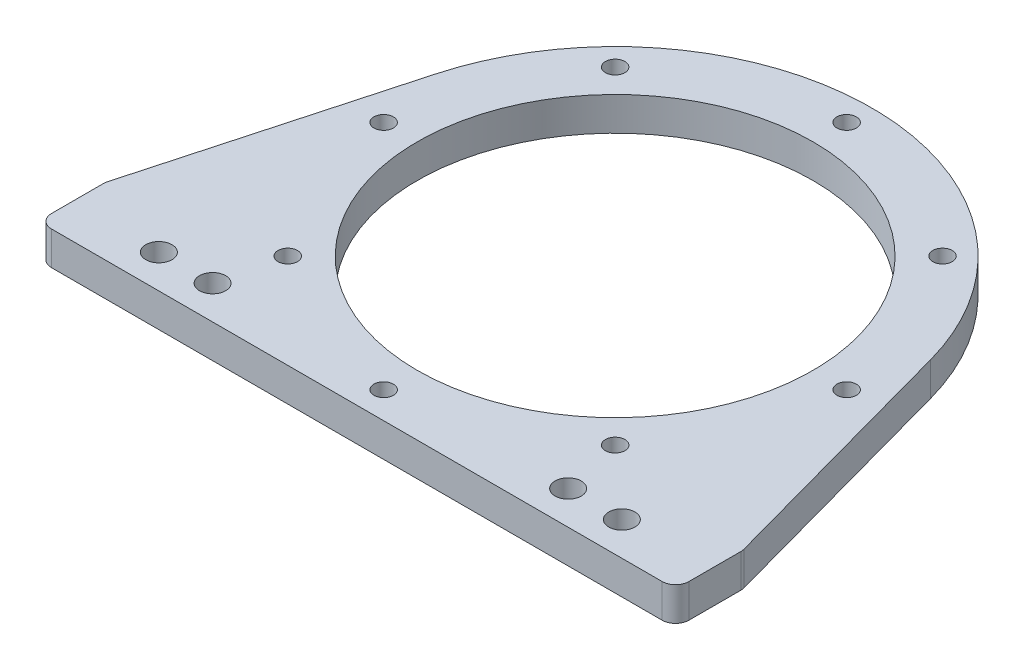
from build123d import *

# Parameters (mm, degrees)
SKETCH_1_R          = 29.5
SKETCH_1_R_2        = 1.45
EXTRUDE_1_DEPTH     = 5
SKETCH_2_R          = 1.95
CUT_EXTRUDE_1_DEPTH = 62.347371582
FILLET_1_R          = 2


with BuildPart() as part:
    # 草图1 → 凸台-拉伸1 (new body)
    with BuildSketch(Plane(origin=(0, 0, 0), x_dir=(1, 0, 0), z_dir=(0, 1, 0))):
        with BuildLine():
            Line((-36.882678944, 10.135605257), (-47.5, -28.5))
            Line((-47.5, -28.5), (-47.5, -38.5))
            Line((-47.5, -38.5), (47.5, -38.5))
            Line((47.5, -38.5), (47.5, -28.5))
            Line((47.5, -28.5), (36.882678944, 10.135605257))
            ThreePointArc((36.882678944, 10.135605257), (0, 38.25), (-36.882678944, 10.135605257))
        make_face()
        with Locations(Location((0, 0, 0), (0, 0, 270))):
            Circle(SKETCH_1_R, mode=Mode.SUBTRACT)
        with Locations(Location((-34.5, 0, 0), (0, 0, 270))):
            Circle(SKETCH_1_R_2, mode=Mode.SUBTRACT)
        with Locations(Location((-24.395183951, 24.395183951, 0), (0, 0, 270))):
            Circle(SKETCH_1_R_2, mode=Mode.SUBTRACT)
        with Locations(Location((0, 34.5, 0), (0, 0, 270))):
            Circle(SKETCH_1_R_2, mode=Mode.SUBTRACT)
        with Locations(Location((24.395183951, 24.395183951, 0), (0, 0, 270))):
            Circle(SKETCH_1_R_2, mode=Mode.SUBTRACT)
        with Locations(Location((34.5, 0, 0), (0, 0, 270))):
            Circle(SKETCH_1_R_2, mode=Mode.SUBTRACT)
        with Locations(Location((24.395183951, -24.395183951, 0), (0, 0, 270))):
            Circle(SKETCH_1_R_2, mode=Mode.SUBTRACT)
        with Locations(Location((0, -34.5, 0), (0, 0, 270))):
            Circle(SKETCH_1_R_2, mode=Mode.SUBTRACT)
        with Locations(Location((-24.395183951, -24.395183951, 0), (0, 0, 270))):
            Circle(SKETCH_1_R_2, mode=Mode.SUBTRACT)
    extrude(amount=EXTRUDE_1_DEPTH)

    # 草图2 → 切除-拉伸1 (cut, through all)
    with BuildSketch(Plane(origin=(0, 5, 0), x_dir=(1, 0, 0), z_dir=(0, 1, 0))):
        with Locations(Location((-34.5, -33.5, 0), (0, 0, 270))):
            Circle(SKETCH_2_R)
        with Locations(Location((-26.5, -33.5, 0), (0, 0, 270))):
            Circle(SKETCH_2_R)
        with Locations(Location((26.5, -33.5, 0), (0, 0, 270))):
            Circle(SKETCH_2_R)
        with Locations(Location((34.5, -33.5, 0), (0, 0, 270))):
            Circle(SKETCH_2_R)
    extrude(amount=-CUT_EXTRUDE_1_DEPTH, mode=Mode.SUBTRACT)

    # 圆角1
    fillet_1_edges = [part.edges().sort_by_distance(p)[0] for p in [
        (47.5, 2.5, 28.5),
        (47.5, 2.5, 38.5),
        (-47.5, 2.5, 38.5),
        (-47.5, 2.5, 28.5),
    ]]
    fillet(fillet_1_edges, radius=FILLET_1_R)


solid = part.part
